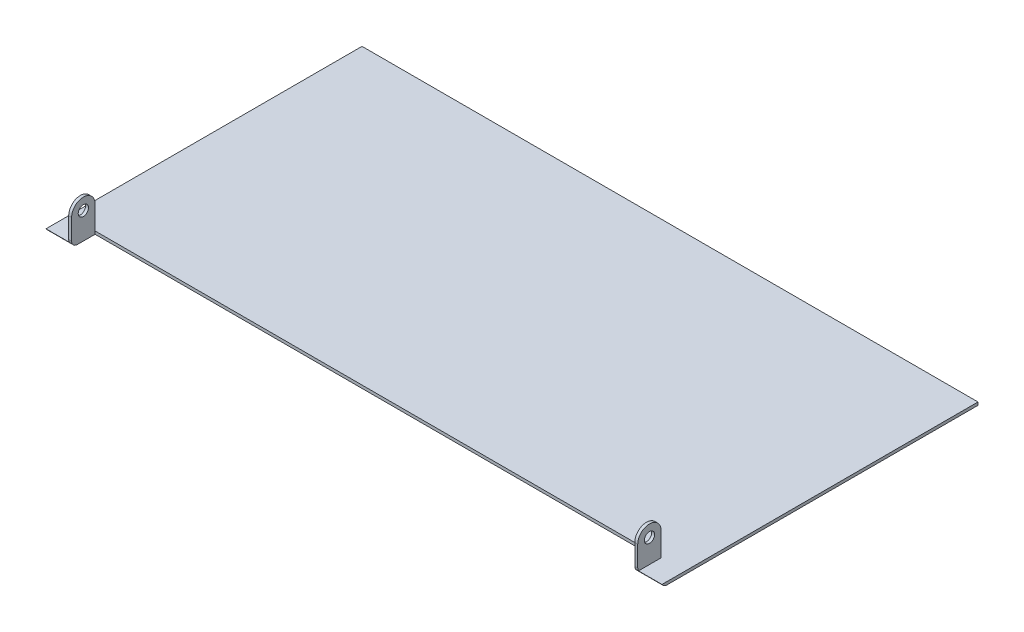
from build123d import *

# Parameters (mm, degrees)
SKETCH1_W           = 194
SKETCH1_H           = 100
BOSS_EXTRUDE1_DEPTH = 1
SKETCH2_R           = 1.75
BOSS_EXTRUDE2_DEPTH = 1
SKETCH5_W           = 8
SKETCH5_H           = 108
BOSS_EXTRUDE3_DEPTH = 1
CUT_EXTRUDE3_DEPTH  = 219.249856816


with BuildPart() as part:
    # Sketch1 → Boss-Extrude1 (new body)
    with BuildSketch(Plane(origin=(0, 0, 0), x_dir=(1, 0, 0), z_dir=(0, 1, 0))):
        Rectangle(SKETCH1_W, SKETCH1_H)
    extrude(amount=BOSS_EXTRUDE1_DEPTH)

    # Sketch2 → Boss-Extrude2 (add)
    with BuildSketch(Plane.ZY.offset(97)):
        with BuildLine():
            Line((58, 0), (58, 9))
            ThreePointArc((58, 9), (54, 13), (50, 9))
            Line((50, 9), (50, 0))
            Line((50, 0), (58, 0))
        make_face()
        with Locations((54, 9)):
            Circle(SKETCH2_R, mode=Mode.SUBTRACT)
    boss_extrude2 = extrude(amount=-BOSS_EXTRUDE2_DEPTH)

    # Mirror1: Boss-Extrude2 across plane
    add(boss_extrude2.mirror(Plane.ZY))

    # Sketch5 → Boss-Extrude3 (add)
    with BuildSketch(Plane(origin=(0, 1, 0), x_dir=(1, 0, 0), z_dir=(0, 1, 0))):
        with Locations((-101, -4)):
            Rectangle(SKETCH5_W, SKETCH5_H)
        with Locations((101, -4)):
            Rectangle(SKETCH5_W, SKETCH5_H)
    extrude(amount=-BOSS_EXTRUDE3_DEPTH)

    # Sketch6 → Cut-Extrude3 (cut, through all)
    with BuildSketch(Plane.ZY.offset(105)):
        with BuildLine():
            Line((58, 0), (56, 0))
            ThreePointArc((56, 0), (57.414213562, 0.585786438), (58, 2))
            Line((58, 2), (58, 0))
        make_face()
    extrude(amount=-CUT_EXTRUDE3_DEPTH, mode=Mode.SUBTRACT)


solid = part.part
